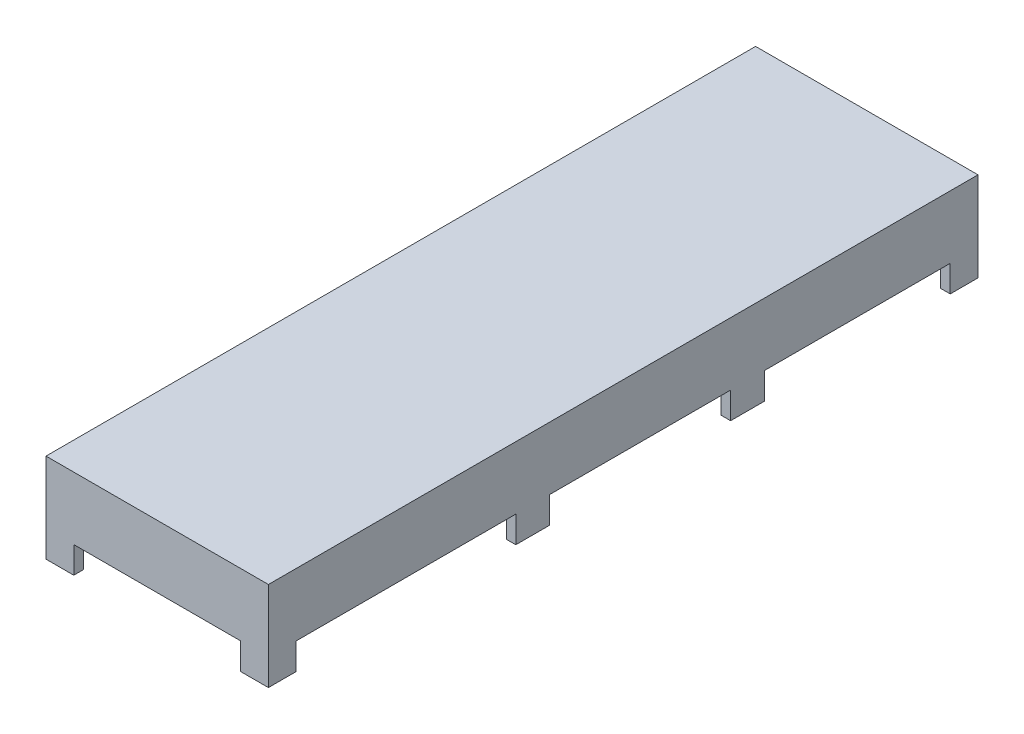
from build123d import *

# Parameters (mm, degrees)
SKETCH_2_W                = 9.215
SKETCH_2_H                = 29.4
EXTRUDE_1_DEPTH           = 3.7
SKETCH_2_5_W              = 8.42
SKETCH_2_5_H              = 28.6
CUT_EXTRUDE_2_DEPTH       = 3.3
CUT_EXTRUDE_7_DEPTH       = 32.031697102
CUT_EXTRUDE_7_DEPTH_BACK  = 0.4
SKETCH_3_W                = 6.915
SKETCH_3_H                = 1.1
CUT_EXTRUDE_11_DEPTH      = 32.031697102
CUT_EXTRUDE_11_DEPTH_BACK = 0.4
SKETCH_14_W               = 7.7
SKETCH_14_H               = 1.1
SKETCH_14_W_2             = 7.5
SKETCH_14_W_3             = 9.1
CUT_EXTRUDE_12_DEPTH      = 10


with BuildPart() as part:
    # 草图2 → 凸台-拉伸1 (new body)
    with BuildSketch(Plane(origin=(0, 0, 0), x_dir=(1, 0, 0), z_dir=(0, 1, 0))):
        with Locations((4.6075, 14.7)):
            Rectangle(SKETCH_2_W, SKETCH_2_H)
    extrude(amount=EXTRUDE_1_DEPTH)

    # 草图2<5> → 切除-拉伸2 (cut)
    with BuildSketch(Plane(origin=(0, 0, 0), x_dir=(1, 0, 0), z_dir=(0, 1, 0))):
        with Locations((4.61, 14.7)):
            Rectangle(SKETCH_2_5_W, SKETCH_2_5_H)
    extrude(amount=CUT_EXTRUDE_2_DEPTH, mode=Mode.SUBTRACT)

    # 草图3 → 切除-拉伸7 (cut, two sides: drawn at the far end of the back side and taken through both)
    with BuildSketch(Plane.XY.offset(-CUT_EXTRUDE_7_DEPTH_BACK)):
        with Locations((4.6075, 0.55)):
            Rectangle(SKETCH_3_W, SKETCH_3_H)
    extrude(amount=CUT_EXTRUDE_7_DEPTH + CUT_EXTRUDE_7_DEPTH_BACK, mode=Mode.SUBTRACT)

    # 草图8 → 切除-拉伸11 (cut, two sides: drawn at the far end of the back side and taken through both)
    with BuildSketch(Plane(origin=(0, 0, -29.4), x_dir=(-1, 0, 0), z_dir=(0, 0, -1)).offset(-CUT_EXTRUDE_11_DEPTH_BACK)):
        Polygon((-39.075133434, 0), (-9.215, 0), (-8.065, 0), (-8.065, 1.1), (-1.15, 1.1), (-1.15, 0), (0, 0), (29.860133434, 0), (29.860133434, -59.720266867), (-39.075133434, -59.720266867), align=None)
    extrude(amount=CUT_EXTRUDE_11_DEPTH + CUT_EXTRUDE_11_DEPTH_BACK, mode=Mode.SUBTRACT)

    # 草图14 → 切除-拉伸12 (cut)
    with BuildSketch(Plane.ZY):
        with Locations((-24.4, 0.55)):
            Rectangle(SKETCH_14_W, SKETCH_14_H)
        with Locations((-15.4, 0.55)):
            Rectangle(SKETCH_14_W_2, SKETCH_14_H)
        with Locations((-5.7, 0.55)):
            Rectangle(SKETCH_14_W_3, SKETCH_14_H)
    extrude(amount=-CUT_EXTRUDE_12_DEPTH, mode=Mode.SUBTRACT)


solid = part.part
